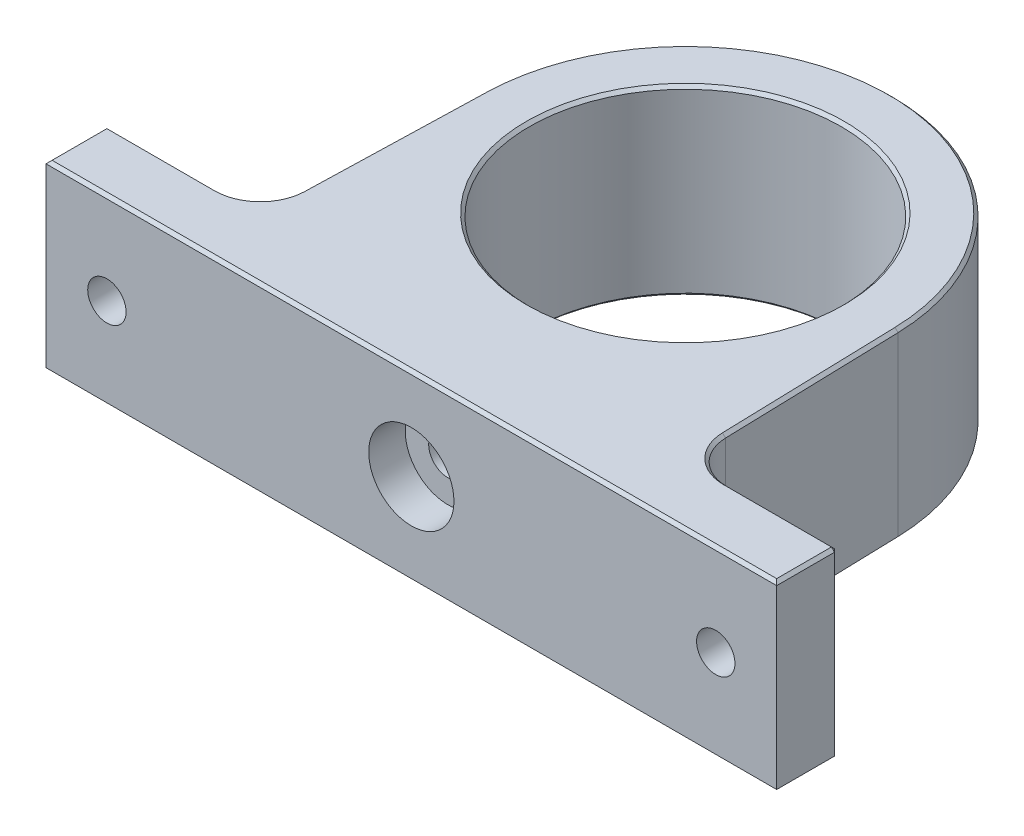
from build123d import *

# Parameters (mm, degrees)
SKETCH1_R           = 25.6
BOSS_EXTRUDE1_DEPTH = 15
SKETCH2_R           = 3.15
CUT_EXTRUDE1_DEPTH  = 30
SKETCH3_R           = 7
CUT_EXTRUDE2_DEPTH  = 6
SKETCH4_R           = 3.15
CUT_EXTRUDE3_DEPTH  = 93.660671285
FILLET1_R           = 7
CHAMFER1_SIZE       = 0.5
CUT_EXTRUDE4_DEPTH  = 33


with BuildPart() as part:
    # Sketch1 → Boss-Extrude1 (new, symmetric)
    with BuildSketch(Plane(origin=(0, 0, 0), x_dir=(1, 0, 0), z_dir=(0, 1, 0))):
        with BuildLine():
            Line((-33.986502727, 0.957931299), (-35, -35))
            Line((-35, -35), (-60, -35))
            Line((-60, -35), (-60, -45))
            Line((-60, -45), (60, -45))
            Line((60, -45), (60, -35))
            Line((60, -35), (35, -35))
            Line((35, -35), (33.986502727, 0.957931299))
            ThreePointArc((33.986502727, 0.957931299), (0, 34), (-33.986502727, 0.957931299))
        make_face()
        with Locations(Location((0, 0, 0), (0, 0, 270))):
            Circle(SKETCH1_R, mode=Mode.SUBTRACT)
    extrude(amount=BOSS_EXTRUDE1_DEPTH, both=True)

    # Sketch2 → Cut-Extrude1 (cut)
    with BuildSketch(Plane.XY.offset(45)):
        Circle(SKETCH2_R)
    extrude(amount=-CUT_EXTRUDE1_DEPTH, mode=Mode.SUBTRACT)

    # Sketch3 → Cut-Extrude2 (cut)
    with BuildSketch(Plane.XY.offset(45)):
        Circle(SKETCH3_R)
    extrude(amount=-CUT_EXTRUDE2_DEPTH, mode=Mode.SUBTRACT)

    # Sketch4 → Cut-Extrude3 (cut, through all)
    with BuildSketch(Plane(origin=(0, 0, 35), x_dir=(-1, 0, 0), z_dir=(0, 0, -1))):
        with Locations((-50, 0)):
            Circle(SKETCH4_R)
        with Locations((50, 0)):
            Circle(SKETCH4_R)
    extrude(amount=-CUT_EXTRUDE3_DEPTH, mode=Mode.SUBTRACT)

    # Fillet1
    fillet1_edges = [part.edges().sort_by_distance(p)[0] for p in [
        (-35, 0, 35),
        (35, 0, 35),
    ]]
    fillet(fillet1_edges, radius=FILLET1_R)

    # Chamfer1
    chamfer1_edges = [part.edges().sort_by_distance(p)[0] for p in [
        (-34.397381029, -15, 13.619644926),
        (0, -15, -34),
        (50.90274024, -15, 35),
        (0, 15, -34),
        (60, 0, 35),
        (-60, 0, 35),
        (-34.397381029, 15, 13.619644926),
        (0, -15, -25.6),
        (0, 15, -25.6),
        (-60, 15, 40),
        (0, 15, 45),
        (60, 15, 40),
        (53.15, 0, 35),
        (-46.85, 0, 35),
        (50.90274024, 15, 35),
        (-50.90274024, -15, 35),
        (-50.90274024, 15, 35),
        (34.397381029, -15, 13.619644926),
        (34.397381029, 15, 13.619644926),
        (-36.9259594, -15, 33.018991335),
        (-36.9259594, 15, 33.018991335),
        (36.9259594, -15, 33.018991335),
        (36.9259594, 15, 33.018991335),
        (60, -15, 40),
        (0, -15, 45),
        (-60, -15, 40),
    ]]
    chamfer(chamfer1_edges, length=CHAMFER1_SIZE)

    # Sketch5 → Cut-Extrude4 (cut)
    with BuildSketch(Plane.XY):
        Polygon((2.944486373, 5.1), (-2.944486373, 5.1), (-5.888972746, 0), (-2.944486373, -5.1), (2.944486373, -5.1), (5.888972746, 0), align=None)
    extrude(amount=CUT_EXTRUDE4_DEPTH, mode=Mode.SUBTRACT)


solid = part.part
